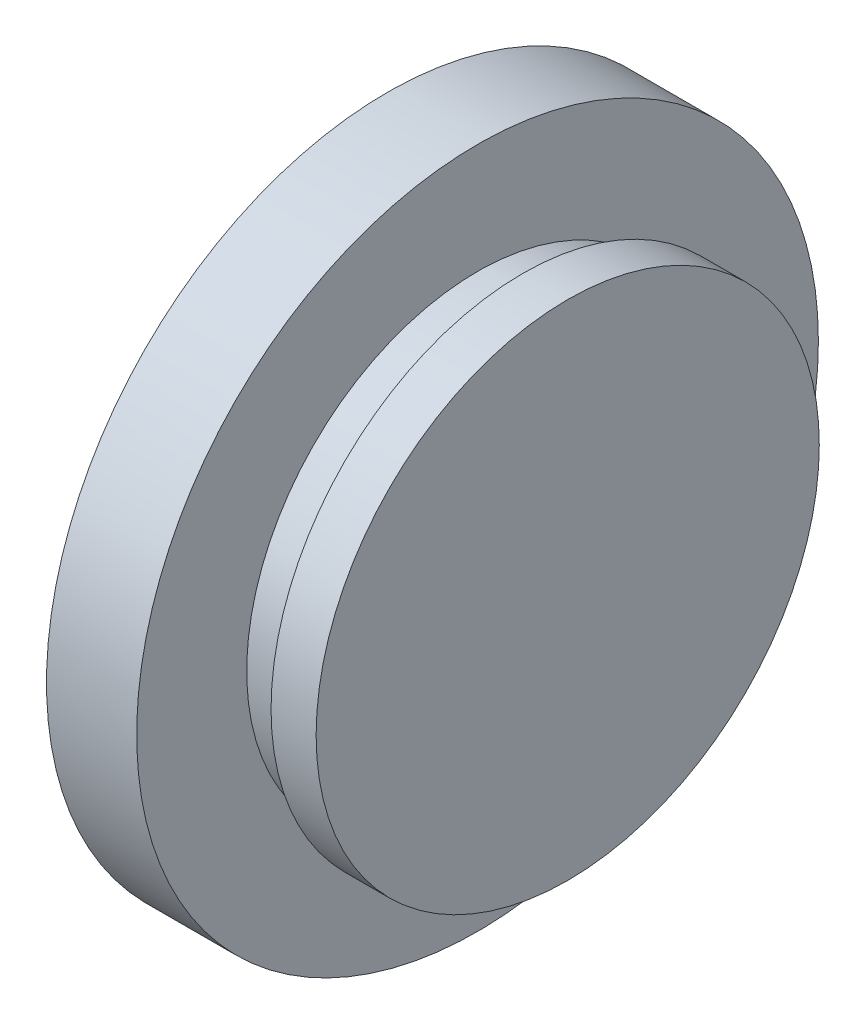
from build123d import *

# Parameters (mm, degrees)
SKETCH2_R           = 18.9
BOSS_EXTRUDE1_DEPTH = 5
SKETCH2_4_R         = 17.9
CUT_EXTRUDE1_DEPTH  = 3.95
SKETCH7_R           = 12.8
BOSS_EXTRUDE2_DEPTH = 2.5
SKETCH8_R           = 13.95
BOSS_EXTRUDE3_DEPTH = 2.5


with BuildPart() as part:
    # Sketch2 → Boss-Extrude1 (new body)
    with BuildSketch(Plane(origin=(0, 0, 0), x_dir=(0, 0, -1), z_dir=(1, 0, 0))):
        Circle(SKETCH2_R)
    extrude(amount=BOSS_EXTRUDE1_DEPTH)

    # Sketch2<4> → Cut-Extrude1 (cut)
    with BuildSketch(Plane(origin=(0, 0, 0), x_dir=(0, 0, -1), z_dir=(1, 0, 0))):
        Circle(SKETCH2_4_R)
    extrude(amount=CUT_EXTRUDE1_DEPTH, mode=Mode.SUBTRACT)

    # Sketch7 → Boss-Extrude2 (add)
    with BuildSketch(Plane(origin=(5, 0, 0), x_dir=(0, 0, -1), z_dir=(1, 0, 0))):
        Circle(SKETCH7_R)
    extrude(amount=BOSS_EXTRUDE2_DEPTH)

    # Sketch8 → Boss-Extrude3 (add)
    with BuildSketch(Plane(origin=(7.5, 0, 0), x_dir=(0, 0, -1), z_dir=(1, 0, 0))):
        Circle(SKETCH8_R)
    extrude(amount=BOSS_EXTRUDE3_DEPTH)


solid = part.part
